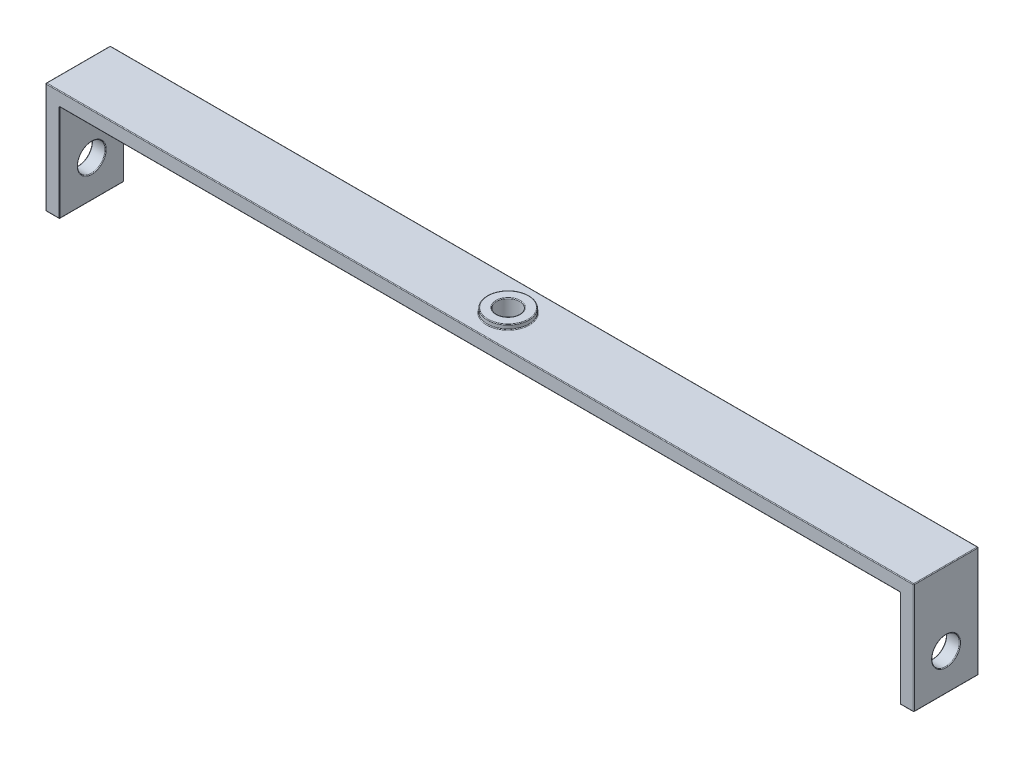
from build123d import *

# Parameters (mm, degrees)
BOSS_EXTRUDE2_DEPTH            = 3.5
BOSS_EXTRUDE2_DEPTH_BACK       = 3.5
SKETCH3_R                      = 1.25
CUT_EXTRUDE6_DEPTH             = 1.5
BOSS_EXTRUDE3_START            = 0.5
SKETCH4_R                      = 2.25
SKETCH4_R_2                    = 1.25
BOSS_EXTRUDE3_DEPTH            = 0.5
CUT_EXTRUDE9_REACH             = 51.041
SKETCH5_R                      = 1.5
CUT_EXTRUDE9_DIRECTION_2_REACH = 51.041
FILLET6_R                      = 0.075


with BuildPart() as part:
    # Sketch1 → Boss-Extrude2 (new, two sides: drawn at the far end of the back side and taken through both)
    with BuildSketch(Plane.XY.offset(-BOSS_EXTRUDE2_DEPTH_BACK)):
        Polygon((-46.579104478, 0), (47.420895522, 0), (47.420895522, -12), (45.920895522, -12), (45.920895522, -1.5), (-45.079104478, -1.5), (-45.079104478, -12), (-46.579104478, -12), align=None)
    extrude(amount=BOSS_EXTRUDE2_DEPTH + BOSS_EXTRUDE2_DEPTH_BACK)

    # Sketch3 → Cut-Extrude6 (cut)
    with BuildSketch(Plane(origin=(0, 0, 0), x_dir=(1, 0, 0), z_dir=(0, 1, 0))):
        with Locations(Location((0, 0, 0), (0, 0, 270))):
            Circle(SKETCH3_R)
    extrude(amount=-CUT_EXTRUDE6_DEPTH, mode=Mode.SUBTRACT)

    # Sketch4 → Boss-Extrude3 (add)
    with BuildSketch(Plane(origin=(0, 0, 0), x_dir=(1, 0, 0), z_dir=(0, 1, 0)).offset(BOSS_EXTRUDE3_START)):
        with Locations(Location((0, 0, 0), (0, 0, 270))):
            Circle(SKETCH4_R)
        with Locations(Location((0, 0, 0), (0, 0, 270))):
            Circle(SKETCH4_R_2, mode=Mode.SUBTRACT)
    extrude(amount=-BOSS_EXTRUDE3_DEPTH)

    # Cut-Extrude9: up to this face of the body (flat: up to its plane)
    cut_extrude9_end = Plane(part.part.faces().sort_by_distance((-46.579104478, -6, 0))[0])
    # Sketch5 → Cut-Extrude9 (cut, up to the picked face)
    with BuildSketch(Plane(origin=(0, 0, 0), x_dir=(0, 0, -1), z_dir=(1, 0, 0)), mode=Mode.PRIVATE) as cut_extrude9_sk1:
        with Locations((0, -8)):
            Circle(SKETCH5_R)
    cut_extrude9_tool1 = split(extrude(cut_extrude9_sk1.sketch, amount=-CUT_EXTRUDE9_REACH, mode=Mode.PRIVATE), bisect_by=cut_extrude9_end, keep=Keep.BOTH, mode=Mode.PRIVATE)
    add(cut_extrude9_tool1.solids().sort_by(Axis((0, -8, 0), (-1, 0, 0)))[0], mode=Mode.SUBTRACT)

    # Cut-Extrude9 direction 2: up to this face of the body (flat: up to its plane)
    cut_extrude9_direction_2_end = Plane(part.part.faces().sort_by_distance((47.420895522, -6, 0))[0])
    # Sketch5 → Cut-Extrude9 direction 2 (cut, up to the picked face)
    with BuildSketch(Plane(origin=(0, 0, 0), x_dir=(0, 0, -1), z_dir=(1, 0, 0)), mode=Mode.PRIVATE) as cut_extrude9_direction_2_sk1:
        with Locations((0, -8)):
            Circle(SKETCH5_R)
    cut_extrude9_direction_2_tool1 = split(extrude(cut_extrude9_direction_2_sk1.sketch, amount=CUT_EXTRUDE9_DIRECTION_2_REACH, mode=Mode.PRIVATE), bisect_by=cut_extrude9_direction_2_end, keep=Keep.BOTH, mode=Mode.PRIVATE)
    add(cut_extrude9_direction_2_tool1.solids().sort_by(Axis((0, -8, 0), (1, 0, 0)))[0], mode=Mode.SUBTRACT)

    # Fillet6
    fillet6_edges = [part.edges().sort_by_distance(p)[0] for p in [
        (-45.079104478, -6.75, -3.5),
        (-46.579104478, 0, 0),
        (47.420895522, 0, 0),
        (47.420895522, -12, 0),
        (45.920895522, -12, 0),
        (45.920895522, -1.5, 0),
        (-45.079104478, -1.5, 0),
        (-45.079104478, -12, 0),
        (-46.579104478, -12, 0),
        (0.420895522, -1.5, -3.5),
        (45.920895522, -6.75, -3.5),
        (-46.579104478, -6, 3.5),
        (-45.829104478, -12, 3.5),
        (-45.079104478, -6.75, 3.5),
        (0.420895522, -1.5, 3.5),
        (45.920895522, -6.75, 3.5),
        (46.670895522, -12, -3.5),
        (46.670895522, -12, 3.5),
        (47.420895522, -6, 3.5),
        (0.420895522, 0, 3.5),
        (47.420895522, -6, -3.5),
        (0.420895522, 0, -3.5),
        (0, -1.5, -1.25),
        (0, 0.5, -2.25),
        (0, 0, -2.25),
        (0, 0.5, -1.25),
        (-46.579104478, -6, -3.5),
        (-45.079104478, -8, 1.5),
        (45.920895522, -8, 1.5),
        (-46.579104478, -8, 1.5),
        (47.420895522, -8, 1.5),
        (-45.829104478, -12, -3.5),
    ]]
    fillet(fillet6_edges, radius=FILLET6_R)


solid = part.part
